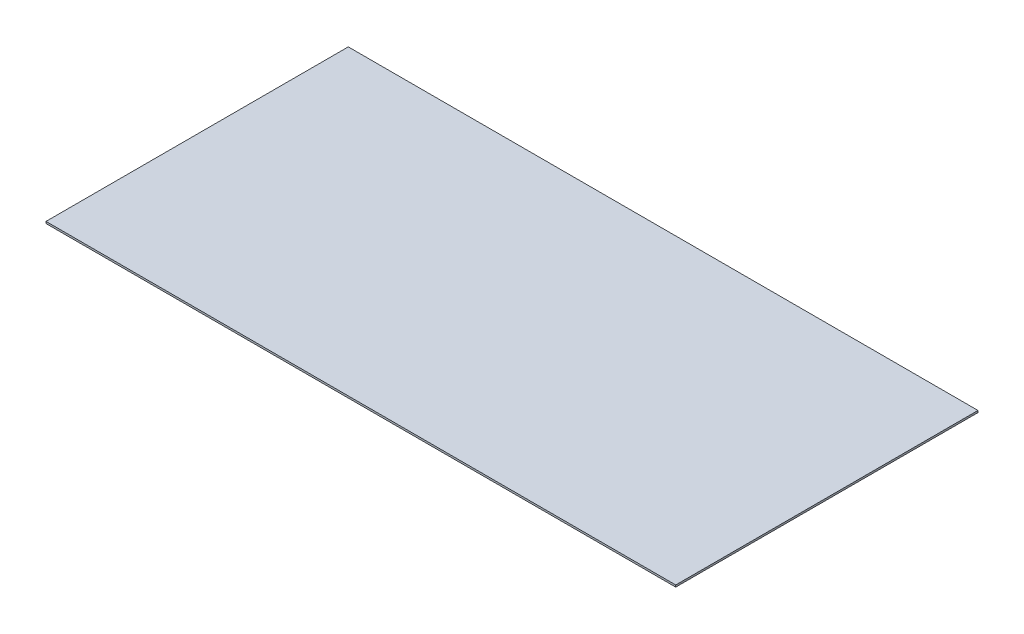
from build123d import *

# Parameters (mm, degrees)
SKETCH1_W           = 50
SKETCH1_H           = 24
BOSS_EXTRUDE1_DEPTH = 0.15


with BuildPart() as part:
    # Sketch1 → Boss-Extrude1 (new body)
    with BuildSketch(Plane(origin=(0, 0, 0), x_dir=(1, 0, 0), z_dir=(0, 1, 0))):
        Rectangle(SKETCH1_W, SKETCH1_H)
    extrude(amount=BOSS_EXTRUDE1_DEPTH)


solid = part.part
